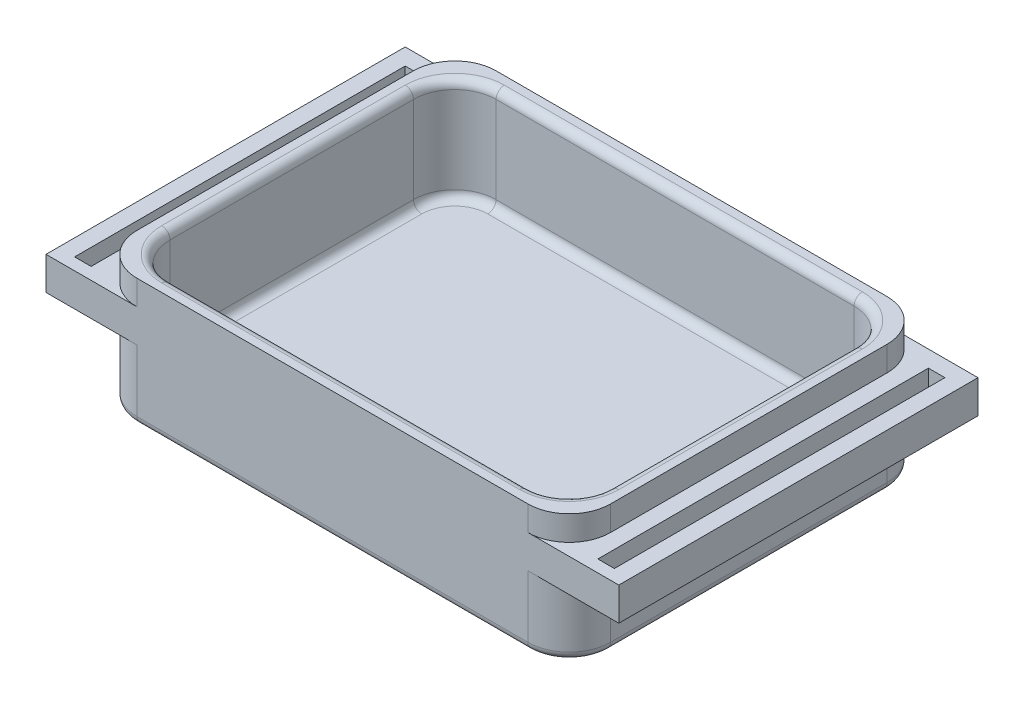
from build123d import *

# Parameters (mm, degrees)
BOSS_EXTRUDE1_DEPTH          = 5
BOSS_EXTRUDE1_DEPTH_BACK     = 7.5
SKETCH2_W                    = 57.31
SKETCH2_H                    = 43.46
SKETCH2_W_2                  = 53.31
SKETCH2_H_2                  = 39.46
FILLET1_R                    = 5
SKETCH3_R                    = 1
BOSS_EXTRUDE2_DEPTH          = 3
CUT_EXTRUDE1_DEPTH           = 2
CUT_EXTRUDE1_DRAFT           = 3
SKETCH5_R                    = 1
CUT_EXTRUDE1_PROFILE_2_DEPTH = 2
CUT_EXTRUDE1_PROFILE_2_DRAFT = 3
CUT_EXTRUDE1_PROFILE_3_DEPTH = 2
CUT_EXTRUDE1_PROFILE_3_DRAFT = 3
FILLET2_R                    = 1
SKETCH6_W                    = 2
SKETCH6_H                    = 40
BOSS_EXTRUDE3_DEPTH          = 2
FILLET3_R                    = 1


with BuildPart() as part:
    # Sketch2 → Boss-Extrude1 (new, two sides: drawn at the far end of the back side and taken through both)
    with BuildSketch(Plane(origin=(0, 0, 0), x_dir=(1, 0, 0), z_dir=(0, 1, 0)).offset(-BOSS_EXTRUDE1_DEPTH_BACK)):
        with Locations((-3, -1.5)):
            Rectangle(SKETCH2_W, SKETCH2_H)
        with Locations((-3, -1.5)):
            Rectangle(SKETCH2_W_2, SKETCH2_H_2, mode=Mode.SUBTRACT)
    extrude(amount=BOSS_EXTRUDE1_DEPTH + BOSS_EXTRUDE1_DEPTH_BACK)

    # Fillet1
    fillet1_edges = [part.edges().sort_by_distance(p)[0] for p in [
        (-29.655, -1.25, 21.23),
        (-29.655, -1.25, -18.23),
        (23.655, -1.25, -18.23),
        (23.655, -1.25, 21.23),
        (-31.655, -1.25, -20.23),
        (25.655, -1.25, -20.23),
        (25.655, -1.25, 23.23),
        (-31.655, -1.25, 23.23),
    ]]
    fillet(fillet1_edges, radius=FILLET1_R)

    # Sketch3 → Boss-Extrude2 (add)
    with BuildSketch(Plane.XZ.offset(7.5)):
        with BuildLine():
            Line((-31.655, 18.23), (-31.655, -15.23))
            ThreePointArc((-31.655, -15.23), (-30.190533906, -18.765533906), (-26.655, -20.23))
            Line((-26.655, -20.23), (20.655, -20.23))
            ThreePointArc((20.655, -20.23), (24.190533906, -18.765533906), (25.655, -15.23))
            Line((25.655, -15.23), (25.655, 18.23))
            ThreePointArc((25.655, 18.23), (24.190533906, 21.765533906), (20.655, 23.23))
            Line((20.655, 23.23), (-26.655, 23.23))
            ThreePointArc((-26.655, 23.23), (-30.190533906, 21.765533906), (-31.655, 18.23))
        make_face()
        with Locations(Location((-18.155, 11.5, 0), (0, 0, 270))):
            Circle(SKETCH3_R, mode=Mode.SUBTRACT)
        with Locations(Location((17.845, 11.5, 0), (0, 0, 270))):
            Circle(SKETCH3_R, mode=Mode.SUBTRACT)
        with Locations(Location((17.845, -12.5, 0), (0, 0, 270))):
            Circle(SKETCH3_R, mode=Mode.SUBTRACT)
    extrude(amount=BOSS_EXTRUDE2_DEPTH)


with BuildPart() as cut_extrude1_tool:
    # Sketch5 → Cut-Extrude1 (with draft: the straight prism first)
    with BuildSketch(Plane.XZ.offset(10.5)):
        Polygon((-18.155, 13.924871131), (-20.255, 12.712435565), (-20.255, 10.287564435), (-18.155, 9.075128869), (-16.055, 10.287564435), (-16.055, 12.712435565), align=None)
    extrude(amount=-CUT_EXTRUDE1_DEPTH)
    # Cut-Extrude1: the draft: its side faces are tilted about the plane it starts from
    cut_extrude1_sides = [cut_extrude1_tool.faces().sort_by_distance(p)[0] for p in [
        (-19.205, -9.5, 13.318653348),
        (-20.255, -9.5, 11.5),
        (-19.205, -9.5, 9.681346652),
        (-17.105, -9.5, 9.681346652),
        (-16.055, -9.5, 11.5),
        (-17.105, -9.5, 13.318653348),
    ]]
    draft(cut_extrude1_sides, Plane.XZ.offset(10.5), CUT_EXTRUDE1_DRAFT)


with BuildPart() as part_1:
    add(part.part)

    # Cut-Extrude1: cut by cut_extrude1_tool
    add(cut_extrude1_tool.part, mode=Mode.SUBTRACT)


with BuildPart() as cut_extrude1_profile_2_tool:
    # Sketch5 → Cut-Extrude1 profile 2 (with draft: the straight prism first)
    with BuildSketch(Plane.XZ.offset(10.5)):
        Polygon((17.857823878, 13.905392128), (15.745, 12.685552694), (15.745, 10.275489302), (17.857823878, 9.055649867), (19.945, 10.260681563), (19.945, 12.700360432), align=None)
        with Locations(Location((17.845, 11.5, 0), (0, 0, 270))):
            Circle(SKETCH5_R, mode=Mode.SUBTRACT)
    extrude(amount=-CUT_EXTRUDE1_PROFILE_2_DEPTH)
    # Cut-Extrude1 profile 2: the draft: its side faces are tilted about the plane it starts from
    cut_extrude1_profile_2_sides = [cut_extrude1_profile_2_tool.faces().sort_by_distance(p)[0] for p in [
        (16.801411939, -9.5, 13.295472411),
        (15.745, -9.5, 11.480520998),
        (16.801411939, -9.5, 9.665569584),
        (18.901411939, -9.5, 9.658165715),
        (19.945, -9.5, 11.480520998),
        (18.901411939, -9.5, 13.30287628),
        (17.845, -9.5, 12.5),
    ]]
    draft(cut_extrude1_profile_2_sides, Plane.XZ.offset(10.5), CUT_EXTRUDE1_PROFILE_2_DRAFT)


with BuildPart() as part_2:
    add(part_1.part)

    # Cut-Extrude1 profile 2: cut by cut_extrude1_profile_2_tool
    add(cut_extrude1_profile_2_tool.part, mode=Mode.SUBTRACT)


with BuildPart() as cut_extrude1_profile_3_tool:
    # Sketch5 → Cut-Extrude1 profile 3 (with draft: the straight prism first)
    with BuildSketch(Plane.XZ.offset(10.5)):
        Polygon((17.833837254, -10.086917044), (15.733837254, -11.299352609), (15.733837254, -13.724223739), (17.833837254, -14.936659305), (19.933837254, -13.724223739), (19.933837254, -11.299352609), align=None)
        with Locations(Location((17.845, -12.5, 0), (0, 0, 270))):
            Circle(SKETCH5_R, mode=Mode.SUBTRACT)
    extrude(amount=-CUT_EXTRUDE1_PROFILE_3_DEPTH)
    # Cut-Extrude1 profile 3: the draft: its side faces are tilted about the plane it starts from
    cut_extrude1_profile_3_sides = [cut_extrude1_profile_3_tool.faces().sort_by_distance(p)[0] for p in [
        (16.783837254, -9.5, -10.693134826),
        (15.733837254, -9.5, -12.511788174),
        (16.783837254, -9.5, -14.330441522),
        (18.883837254, -9.5, -14.330441522),
        (19.933837254, -9.5, -12.511788174),
        (18.883837254, -9.5, -10.693134826),
        (17.845, -9.5, -11.5),
    ]]
    draft(cut_extrude1_profile_3_sides, Plane.XZ.offset(10.5), CUT_EXTRUDE1_PROFILE_3_DRAFT)


with BuildPart() as part_3:
    add(part_2.part)

    # Cut-Extrude1 profile 3: cut by cut_extrude1_profile_3_tool
    add(cut_extrude1_profile_3_tool.part, mode=Mode.SUBTRACT)

    # Fillet2
    fillet2_edges = [part_3.edges().sort_by_distance(p)[0] for p in [
        (-3, 5, 21.23),
        (-29.655, 5, 1.5),
        (-3, 5, -18.23),
        (23.655, 5, 1.5),
        (-3, -7.5, -18.23),
        (-29.655, -7.5, 1.5),
        (-3, -7.5, 21.23),
        (23.655, -7.5, 1.5),
        (22.190533906, 5, 19.765533906),
        (22.190533906, -7.5, 19.765533906),
        (-28.190533906, 5, 19.765533906),
        (-28.190533906, -7.5, 19.765533906),
        (22.190533906, 5, -16.765533906),
        (22.190533906, -7.5, -16.765533906),
        (-28.190533906, 5, -16.765533906),
        (-28.190533906, -7.5, -16.765533906),
    ]]
    fillet(fillet2_edges, radius=FILLET2_R)

    # Sketch6 → Boss-Extrude3 (add, symmetric)
    # profile 1 of 2: a face of its own
    with BuildSketch(Plane(origin=(0, 0, 0), x_dir=(1, 0, 0), z_dir=(0, 1, 0))):
        with BuildLine():
            Line((-37.655, 20.23), (-37.655, -23.23))
            Line((-37.655, -23.23), (-26.655, -23.23))
            ThreePointArc((-26.655, -23.23), (-30.190533906, -21.765533906), (-31.655, -18.23))
            Line((-31.655, -18.23), (-31.655, 15.23))
            ThreePointArc((-31.655, 15.23), (-30.190533906, 18.765533906), (-26.655, 20.23))
            Line((-26.655, 20.23), (-37.655, 20.23))
        make_face()
        with Locations((-34.655, -1.77)):
            Rectangle(SKETCH6_W, SKETCH6_H, mode=Mode.SUBTRACT)
    # profile 2 of 2: a face of its own
    with BuildSketch(Plane(origin=(0, 0, 0), x_dir=(1, 0, 0), z_dir=(0, 1, 0))):
        with BuildLine():
            Line((20.655, 20.23), (31.655, 20.23))
            Line((31.655, 20.23), (31.655, -23.23))
            Line((31.655, -23.23), (20.655, -23.23))
            ThreePointArc((20.655, -23.23), (24.190533906, -21.765533906), (25.655, -18.23))
            Line((25.655, -18.23), (25.655, 15.23))
            ThreePointArc((25.655, 15.23), (24.190533906, 18.765533906), (20.655, 20.23))
        make_face()
        with Locations((28.655, -1.77)):
            Rectangle(SKETCH6_W, SKETCH6_H, mode=Mode.SUBTRACT)
    extrude(amount=BOSS_EXTRUDE3_DEPTH, both=True)

    # Fillet3
    fillet3_edges = [part_3.edges().sort_by_distance(p)[0] for p in [
        (-30.190533906, -10.5, 21.765533906),
        (-31.655, -10.5, 1.5),
        (-30.190533906, -10.5, -18.765533906),
        (-3, -10.5, -20.23),
        (24.190533906, -10.5, -18.765533906),
        (25.655, -10.5, 1.5),
        (24.190533906, -10.5, 21.765533906),
        (-3, -10.5, 23.23),
    ]]
    fillet(fillet3_edges, radius=FILLET3_R)


solid = part_3.part
